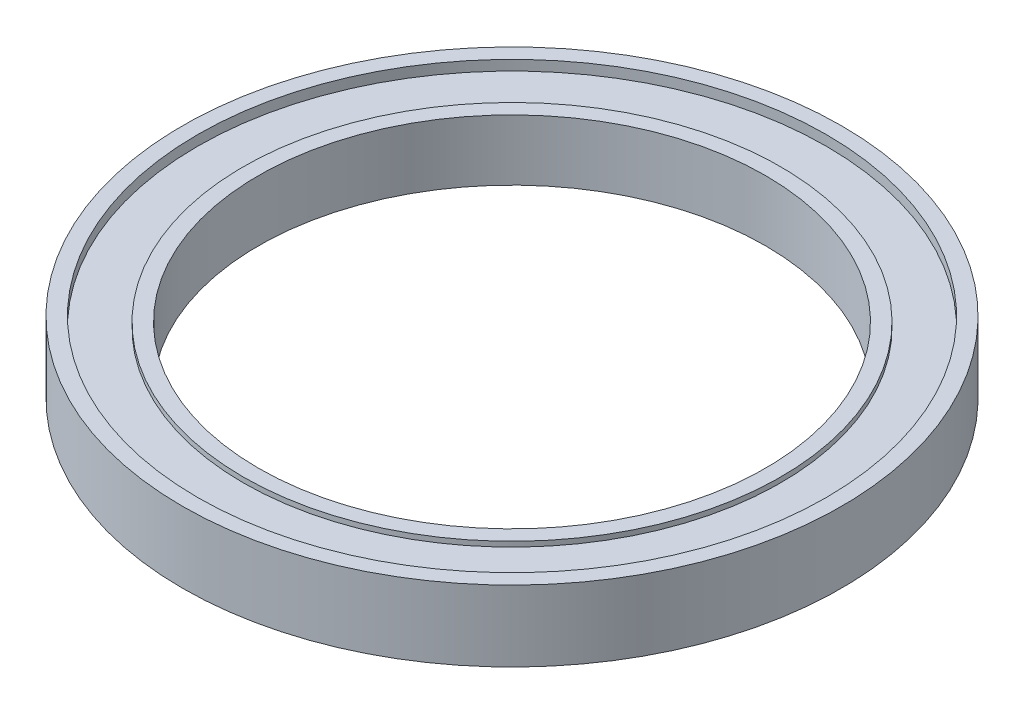
from build123d import *

# Parameters (mm, degrees)
CROQUIS1_R                 = 32.5
CROQUIS1_R_2               = 25
SALIENTE_EXTRUIR1_DEPTH    = 7
INTERNAL_SEAL_SKETCH_R     = 31
INTERNAL_SEAL_SKETCH_R_2   = 26.5
CORTAR_EXTRUIR1_DEPTH      = 1
INTERNAL_ADJUST_SKETCH_R   = 26.5
INTERNAL_ADJUST_SKETCH_R_2 = 25
CORTAR_EXTRUIR2_DEPTH      = 0.5


with BuildPart() as part:
    # Croquis1 → Saliente-Extruir1 (new body)
    with BuildSketch(Plane(origin=(0, 0, 0), x_dir=(1, 0, 0), z_dir=(0, 1, 0))):
        with Locations(Location((0, 0, 0), (0, 0, 270))):
            Circle(CROQUIS1_R)
        with Locations(Location((0, 0, 0), (0, 0, 270))):
            Circle(CROQUIS1_R_2, mode=Mode.SUBTRACT)
    extrude(amount=SALIENTE_EXTRUIR1_DEPTH)

    # Internal seal sketch → Cortar-Extruir1 (cut)
    with BuildSketch(Plane(origin=(0, 7, 0), x_dir=(1, 0, 0), z_dir=(0, 1, 0))):
        with Locations(Location((0, 0, 0), (0, 0, 270))):
            Circle(INTERNAL_SEAL_SKETCH_R)
        with Locations(Location((0, 0, 0), (0, 0, 270))):
            Circle(INTERNAL_SEAL_SKETCH_R_2, mode=Mode.SUBTRACT)
    cortar_extruir1 = extrude(amount=-CORTAR_EXTRUIR1_DEPTH, mode=Mode.SUBTRACT)

    # Internal adjust sketch → Cortar-Extruir2 (cut)
    with BuildSketch(Plane(origin=(0, 7, 0), x_dir=(1, 0, 0), z_dir=(0, 1, 0))):
        with Locations(Location((0, 0, 0), (0, 0, 270))):
            Circle(INTERNAL_ADJUST_SKETCH_R)
        with Locations(Location((0, 0, 0), (0, 0, 270))):
            Circle(INTERNAL_ADJUST_SKETCH_R_2, mode=Mode.SUBTRACT)
    cortar_extruir2 = extrude(amount=-CORTAR_EXTRUIR2_DEPTH, mode=Mode.SUBTRACT)

    # Simetría1: Cortar-Extruir1, Cortar-Extruir2 across plane
    add(cortar_extruir1.mirror(Plane.ZX.offset(3.5)), mode=Mode.SUBTRACT)
    add(cortar_extruir2.mirror(Plane.ZX.offset(3.5)), mode=Mode.SUBTRACT)


solid = part.part
